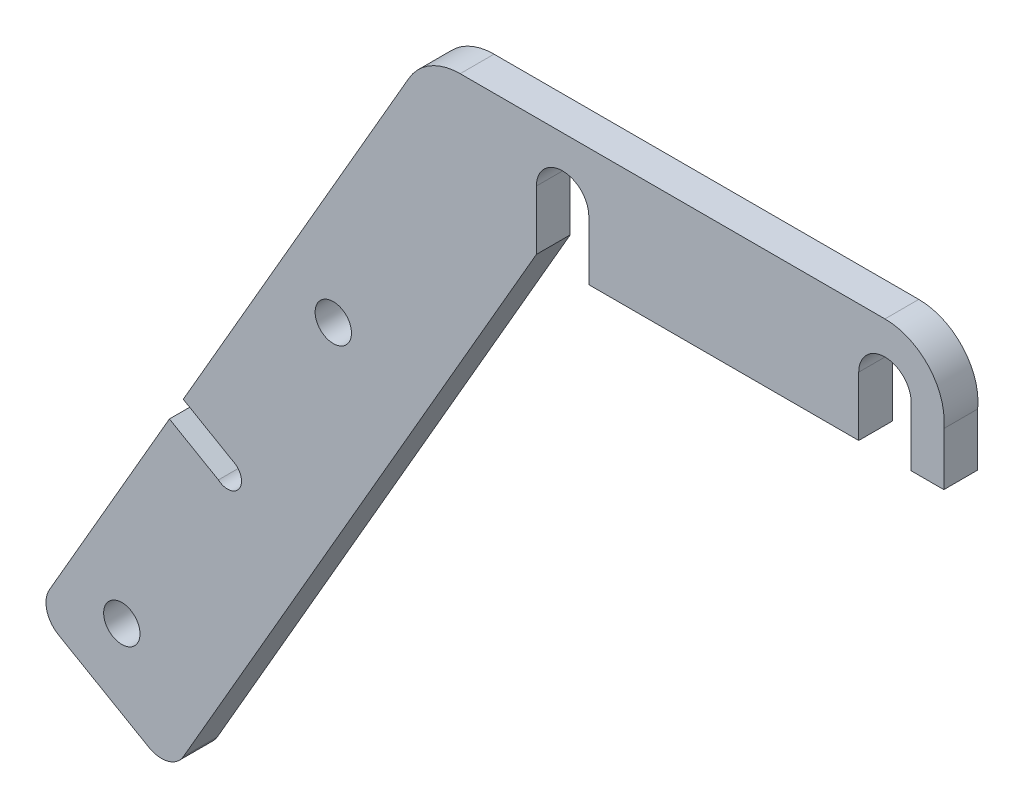
from build123d import *

# Parameters (mm, degrees)
SKETCH1_R           = 2.15
BOSS_EXTRUDE1_DEPTH = 4


with BuildPart() as part:
    # Sketch1 → Boss-Extrude1 (new body)
    with BuildSketch(Plane.XY):
        with BuildLine():
            Line((-3.1, -7), (-3.1, 0))
            ThreePointArc((-3.1, 0), (0, 3.1), (3.1, 0))
            Line((3.1, 0), (3.1, -7))
            Line((3.1, -7), (35.005, -7))
            Line((35.005, -7), (35.005, 0))
            ThreePointArc((35.005, 0), (38.105, 3.1), (41.205, 0))
            Line((41.205, 0), (41.205, -7))
            Line((41.205, -7), (45.064925835, -7))
            Line((45.064925835, -7), (45.064925835, -0.747952118))
            ThreePointArc((45.064925835, -0.747952118), (43.312478508, 4.677837918), (38.105, 7))
            Line((38.105, 7), (-12.106664199, 7))
            ThreePointArc((-12.106664199, 7), (-15.606664199, 6.062177826), (-18.168842026, 3.5))
            Line((-18.168842026, 3.5), (-44.843842026, -42.702455292))
            Line((-44.843842026, -42.702455292), (-38.781664199, -46.202455292))
            ThreePointArc((-38.781664199, -46.202455292), (-38.263860854, -48.590239831), (-40.690427119, -48.875566784))
            Line((-40.690427119, -48.875566784), (-46.478523985, -45.5338075))
            Line((-46.478523985, -45.5338075), (-60.668842026, -70.112159322))
            ThreePointArc((-60.668842026, -70.112159322), (-60.968543293, -72.388616457), (-59.570765814, -74.210235533))
            Line((-59.570765814, -74.210235533), (-48.918653348, -80.360235533))
            ThreePointArc((-48.918653348, -80.360235533), (-46.642196213, -80.659936801), (-44.820577137, -79.262159322))
            Line((-44.820577137, -79.262159322), (-3.1, -7))
        make_face()
        with Locations((-52.106664199, -69.282032303)):
            Circle(SKETCH1_R, mode=Mode.SUBTRACT)
        with Locations((-27.106664199, -25.980762114)):
            Circle(SKETCH1_R, mode=Mode.SUBTRACT)
    extrude(amount=BOSS_EXTRUDE1_DEPTH)


solid = part.part
